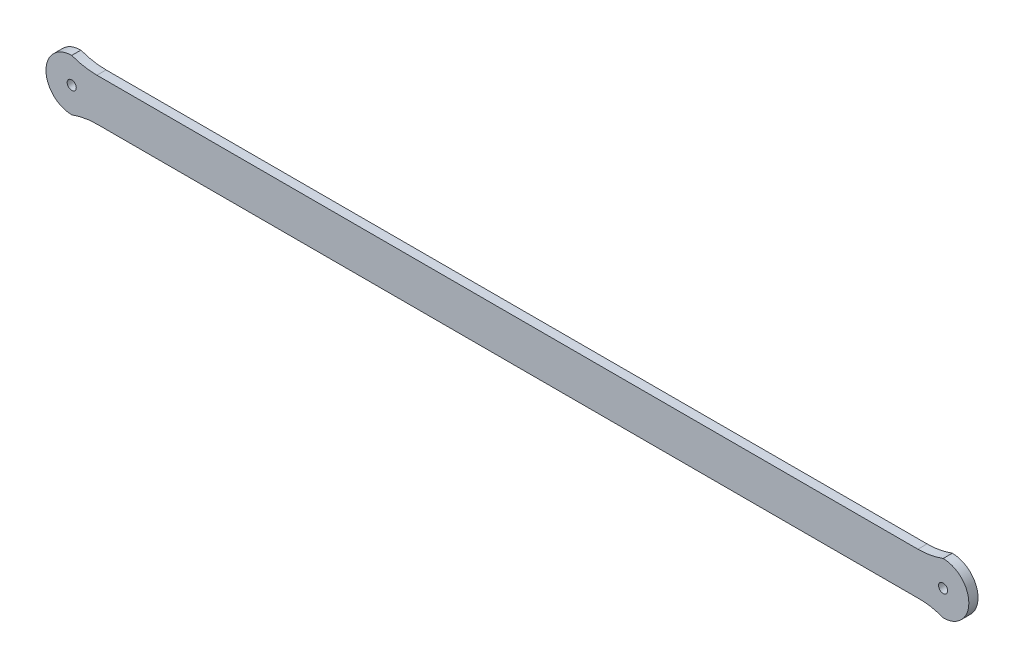
from build123d import *

# Parameters (mm, degrees)
SKETCH1_R           = 1.5875
BOSS_EXTRUDE1_DEPTH = 1.6


with BuildPart() as part:
    # Sketch1 → Boss-Extrude1 (new, symmetric)
    with BuildSketch(Plane.XY):
        with BuildLine():
            Line((-143.274111577, 7.39), (143.274111608, 7.39))
            ThreePointArc((143.274111608, 7.39), (147.74272521, 7.792581352), (152.070006331, 8.978))
            ThreePointArc((152.070006331, 8.978), (161.04800313, -3.115e-06), (152.070000015, -8.977999914))
            ThreePointArc((152.070000015, -8.977999914), (147.755008516, -7.718567431), (143.272000016, -7.389999914))
            Line((143.272000016, -7.389999914), (-143.271999985, -7.389999914))
            ThreePointArc((-143.271999985, -7.389999914), (-147.739885513, -7.802353266), (-152.069999985, -8.977999914))
            ThreePointArc((-152.069999985, -8.977999914), (-161.047999985, 8.6e-08), (-152.069999985, 8.978000086))
            ThreePointArc((-152.069999985, 8.978000086), (-147.743155019, 7.790183335), (-143.274111577, 7.39))
        make_face()
        with Locations((-152.069999985, 8.6e-08)):
            Circle(SKETCH1_R, mode=Mode.SUBTRACT)
        with Locations((152.070003173, 4.3e-08)):
            Circle(SKETCH1_R, mode=Mode.SUBTRACT)
    extrude(amount=BOSS_EXTRUDE1_DEPTH, both=True)


solid = part.part
